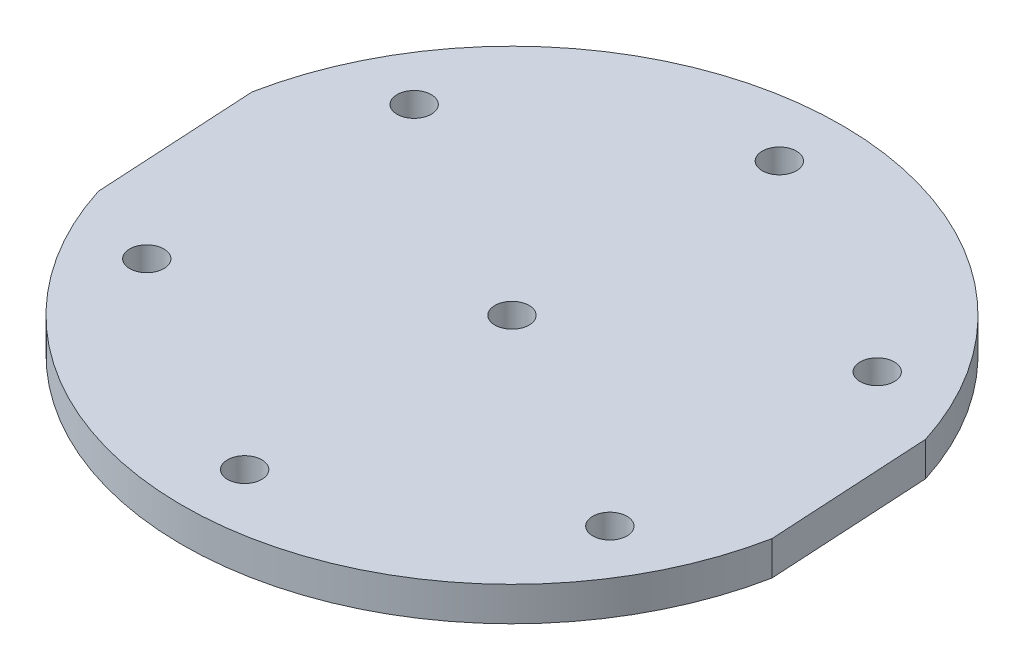
from build123d import *

# Parameters (mm, degrees)
SKETCH_1_R               = 2.5
EXTRUDE_1_DEPTH          = 5
SKETCH_2_R               = 2.5
CUT_EXTRUDE_1_DEPTH      = 20
PATTERN_CIRCULAR_1_COUNT = 6


with BuildPart() as part:
    # Эскиз1 → Бобышка-Вытянуть1 (new body)
    with BuildSketch(Plane(origin=(0, 0, 0), x_dir=(1, 0, 0), z_dir=(0, 1, 0))):
        with BuildLine():
            Line((45.954799299, 14.53947803), (47.297271453, -9.284832422))
            ThreePointArc((47.297271453, -9.284832422), (2.711712187, -48.123659639), (-45.954799299, -14.53947803))
            Line((-45.954799299, -14.53947803), (-47.297271453, 9.284832422))
            ThreePointArc((-47.297271453, 9.284832422), (-2.711712187, 48.123659639), (45.954799299, 14.53947803))
        make_face()
        with Locations(Location((0, 0, 0), (0, 0, 270))):
            Circle(SKETCH_1_R, mode=Mode.SUBTRACT)
    extrude(amount=EXTRUDE_1_DEPTH)

    # Эскиз2 → Вырез-Вытянуть1 (cut)
    with BuildSketch(Plane(origin=(0, 5, 0), x_dir=(1, 0, 0), z_dir=(0, 1, 0))):
        with Locations(Location((0, 39.1, 0), (0, 0, 270))):
            Circle(SKETCH_2_R)
    cut_extrude_1 = extrude(amount=-CUT_EXTRUDE_1_DEPTH, mode=Mode.SUBTRACT)

    # Круговой массив1: Вырез-Вытянуть1 ×6 about axis
    pattern_circular_1_axis = Axis((0, 0, 0), (0, 1, 0))
    for i in range(1, PATTERN_CIRCULAR_1_COUNT):
        add(cut_extrude_1.rotate(pattern_circular_1_axis, i * 360 / PATTERN_CIRCULAR_1_COUNT), mode=Mode.SUBTRACT)


solid = part.part
